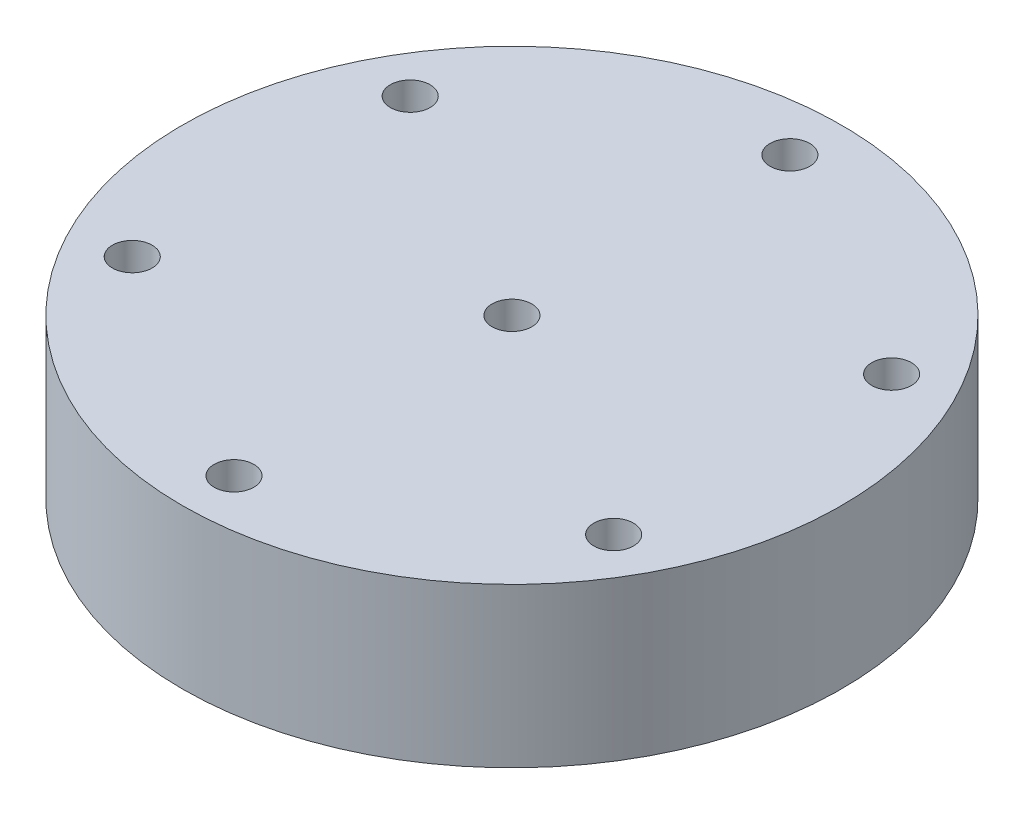
from build123d import *

# Parameters (mm, degrees)
SKETCH1_R                     = 41.5
MAIN_PLATE_DEPTH              = 20
SKETCH3_R                     = 2.5
MOMO_SPARKO_DEPTH             = 63.004032127
SKETCH6_R                     = 4.75
MOMO_SPARKO_SCREW_HEADS_DEPTH = 16
SKETCH7_W                     = 26
SKETCH7_H                     = 26
CUT_EXTRUDE1_DEPTH            = 15
SKETCH8_R                     = 2.5
CUT_EXTRUDE2_DEPTH            = 63.004032127


with BuildPart() as part:
    # Sketch1 → Main Plate (new body)
    with BuildSketch(Plane(origin=(0, 0, 0), x_dir=(1, 0, 0), z_dir=(0, 1, 0))):
        with Locations(Location((0, 0, 0), (0, 0, 270))):
            Circle(SKETCH1_R)
    extrude(amount=MAIN_PLATE_DEPTH)

    # Sketch3 → Momo - Sparko (cut, through all)
    with BuildSketch(Plane(origin=(0, 20, 0), x_dir=(1, 0, 0), z_dir=(0, 1, 0))):
        with Locations(Location((0, 35, 0), (0, 0, 270))):
            Circle(SKETCH3_R)
        with Locations(Location((30.310889132, 17.5, 0), (0, 0, 270))):
            Circle(SKETCH3_R)
        with Locations(Location((30.310889132, -17.5, 0), (0, 0, 270))):
            Circle(SKETCH3_R)
        with Locations(Location((0, -35, 0), (0, 0, 270))):
            Circle(SKETCH3_R)
        with Locations(Location((-30.310889132, -17.5, 0), (0, 0, 270))):
            Circle(SKETCH3_R)
        with Locations(Location((-30.310889132, 17.5, 0), (0, 0, 270))):
            Circle(SKETCH3_R)
    extrude(amount=-MOMO_SPARKO_DEPTH, mode=Mode.SUBTRACT)

    # Sketch6 → Momo - Sparko Screw Heads (cut)
    with BuildSketch(Plane.XZ):
        with Locations(Location((0, 35, 0), (0, 0, 270))):
            Circle(SKETCH6_R)
        with Locations(Location((30.310889132, 17.5, 0), (0, 0, 270))):
            Circle(SKETCH6_R)
        with Locations(Location((30.310889132, -17.5, 0), (0, 0, 270))):
            Circle(SKETCH6_R)
        with Locations(Location((0, -35, 0), (0, 0, 270))):
            Circle(SKETCH6_R)
        with Locations(Location((-30.310889132, -17.5, 0), (0, 0, 270))):
            Circle(SKETCH6_R)
        with Locations(Location((-30.310889132, 17.5, 0), (0, 0, 270))):
            Circle(SKETCH6_R)
    extrude(amount=-MOMO_SPARKO_SCREW_HEADS_DEPTH, mode=Mode.SUBTRACT)

    # Sketch7 → Cut-Extrude1 (cut)
    with BuildSketch(Plane.XZ):
        Rectangle(SKETCH7_W, SKETCH7_H)
    extrude(amount=-CUT_EXTRUDE1_DEPTH, mode=Mode.SUBTRACT)

    # Sketch8 → Cut-Extrude2 (cut, through all)
    with BuildSketch(Plane(origin=(0, 20, 0), x_dir=(1, 0, 0), z_dir=(0, 1, 0))):
        with Locations(Location((0, 0, 0), (0, 0, 270))):
            Circle(SKETCH8_R)
    extrude(amount=-CUT_EXTRUDE2_DEPTH, mode=Mode.SUBTRACT)


solid = part.part
